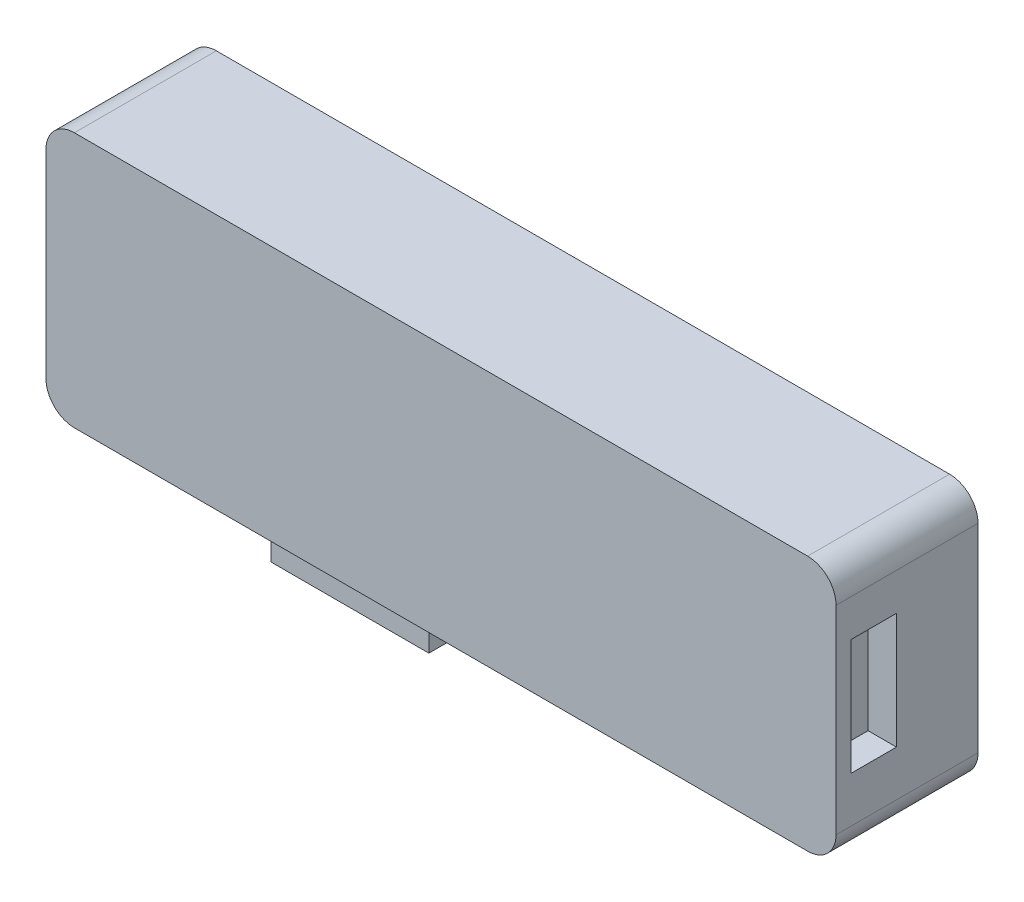
from build123d import *

# Parameters (mm, degrees)
BOSS_EXTRUDE1_DEPTH = 12.7
SKETCH2_W           = 4.090641248
SKETCH2_H           = 10.364450922
CUT_EXTRUDE1_DEPTH  = 2.54
SKETCH3_W           = 14.14
SKETCH3_H           = 6.54
SKETCH3_W_2         = 5.008
SKETCH3_H_2         = 2.508
BOSS_EXTRUDE2_DEPTH = 4.39457265


with BuildPart() as part:
    # Sketch1 → Boss-Extrude1 (new body)
    with BuildSketch(Plane.XY):
        with BuildLine():
            Line((-19.05, 11.43), (46.542212097, 11.43))
            ThreePointArc((46.542212097, 11.43), (48.338263321, 10.686051224), (49.082212097, 8.89))
            Line((49.082212097, 8.89), (49.082212097, -8.89))
            ThreePointArc((49.082212097, -8.89), (48.338263321, -10.686051224), (46.542212097, -11.43))
            Line((46.542212097, -11.43), (-19.05, -11.43))
            ThreePointArc((-19.05, -11.43), (-20.846051224, -10.686051224), (-21.59, -8.89))
            Line((-21.59, -8.89), (-21.59, 8.89))
            ThreePointArc((-21.59, 8.89), (-20.846051224, 10.686051224), (-19.05, 11.43))
        make_face()
    extrude(amount=-BOSS_EXTRUDE1_DEPTH)

    # Sketch2 → Cut-Extrude1 (cut)
    with BuildSketch(Plane(origin=(49.082212097, 0, 0), x_dir=(0, 0, -1), z_dir=(1, 0, 0))):
        with Locations((3.362716068, 0.383061409)):
            Rectangle(SKETCH2_W, SKETCH2_H)
    extrude(amount=-CUT_EXTRUDE1_DEPTH, mode=Mode.SUBTRACT)

    # Sketch3 → Boss-Extrude2 (add)
    with BuildSketch(Plane.XZ.offset(11.43)):
        with Locations((2.794, -6.064)):
            Rectangle(SKETCH3_W, SKETCH3_H)
        with Locations((2.794, -6.064)):
            Rectangle(SKETCH3_W_2, SKETCH3_H_2, mode=Mode.SUBTRACT)
    extrude(amount=BOSS_EXTRUDE2_DEPTH)


solid = part.part
